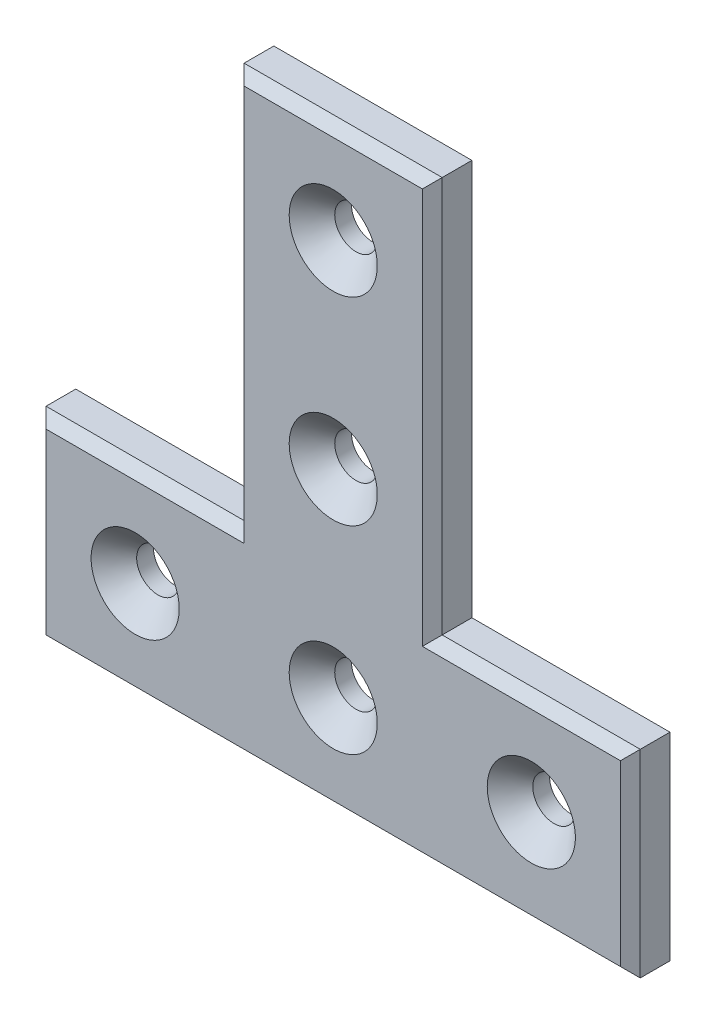
from build123d import *

# Parameters (mm, degrees)
SKETCH1_R           = 2.15
BOSS_EXTRUDE1_DEPTH = 4
CHAMFER2_SIZE       = 2.3
CHAMFER3_SIZE       = 1


with BuildPart() as part:
    # Sketch1 → Boss-Extrude1 (new body)
    with BuildSketch(Plane.XY):
        Polygon((10, 10), (30, 10), (30, -10), (-30, -10), (-30, 10), (-10, 10), (-10, 50), (10, 50), align=None)
        with Locations((0, 20)):
            Circle(SKETCH1_R, mode=Mode.SUBTRACT)
        with Locations((20, 0)):
            Circle(SKETCH1_R, mode=Mode.SUBTRACT)
        with Locations((-20, 0)):
            Circle(SKETCH1_R, mode=Mode.SUBTRACT)
        with Locations((0, 40)):
            Circle(SKETCH1_R, mode=Mode.SUBTRACT)
        Circle(SKETCH1_R, mode=Mode.SUBTRACT)
    extrude(amount=BOSS_EXTRUDE1_DEPTH)

    # Chamfer2
    chamfer2_edges = [part.edges().sort_by_distance(p)[0] for p in [
        (17.85, 0, 4),
        (-2.15, 20, 4),
        (-22.15, 0, 4),
        (-2.15, 40, 4),
        (-2.15, 0, 4),
    ]]
    chamfer(chamfer2_edges, length=CHAMFER2_SIZE)

    # Chamfer3
    chamfer3_edges = [part.edges().sort_by_distance(p)[0] for p in [
        (10, 30, 4),
        (0, 50, 4),
        (-10, 30, 4),
        (-20, 10, 4),
        (-30, 0, 4),
        (0, -10, 4),
        (30, 0, 4),
        (20, 10, 4),
    ]]
    chamfer(chamfer3_edges, length=CHAMFER3_SIZE)


solid = part.part
